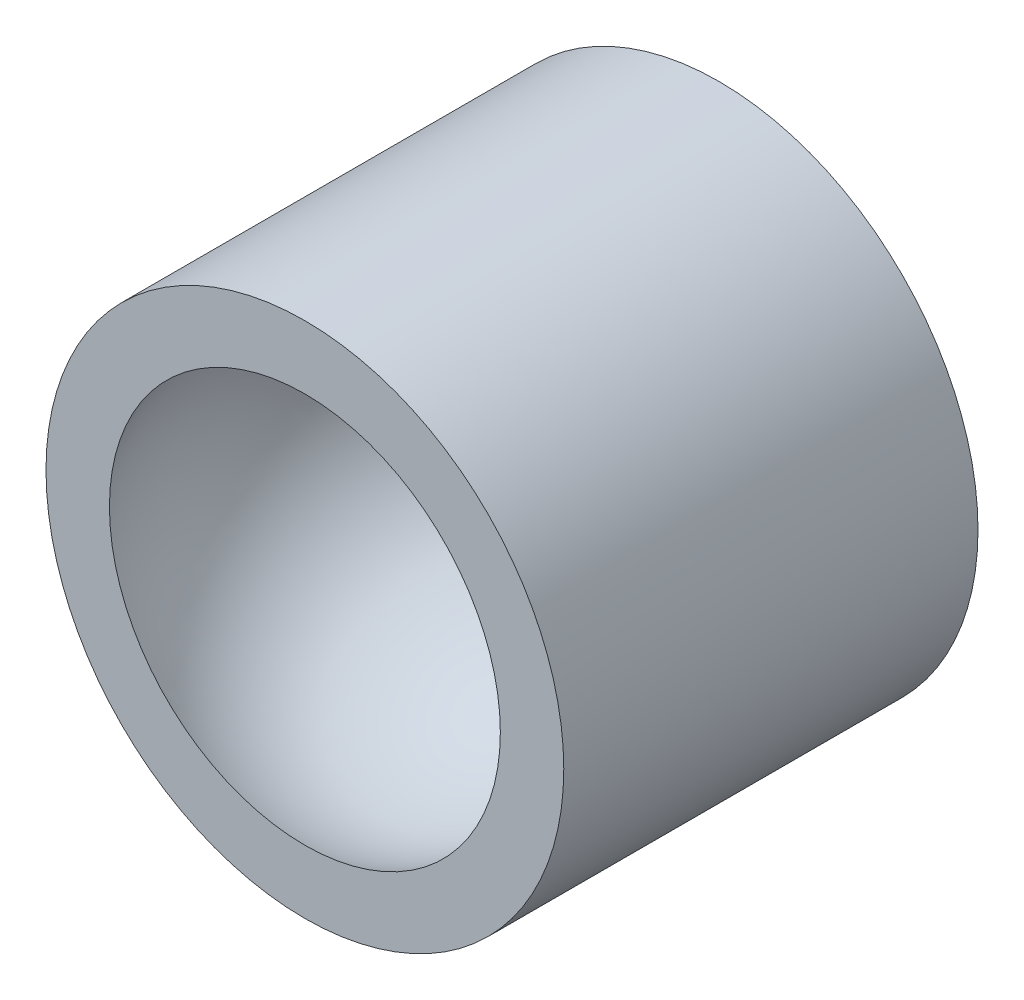
from build123d import *

# Parameters (mm, degrees)
SKETCH_1_R          = 12.5
EXTRUDE_2_DEPTH     = 35
SKETCH_4_R          = 14.624451674
CUT_EXTRUDE_1_DEPTH = 15


with BuildPart() as part:
    # 스케치1 → 보스-돌출2 (new body)
    with BuildSketch(Plane.XY):
        Circle(SKETCH_1_R)
    extrude(amount=EXTRUDE_2_DEPTH)

    # 스케치3 → 컷-회전1 (revolve, cut)
    with BuildSketch(Plane(origin=(0, 0, 0), x_dir=(1, 0, 0), z_dir=(0, 1, 0))):
        with BuildLine():
            Line((0, -21), (0, -41))
            ThreePointArc((0, -41), (-10, -31), (0, -21))
        make_face()
    revolve(axis=Axis((0, 0, 35), (0, 0, -1)), mode=Mode.SUBTRACT)

    # 스케치4 → 컷-돌출1 (cut)
    with BuildSketch(Plane(origin=(0, 0, 0), x_dir=(-1, 0, 0), z_dir=(0, 0, -1))):
        Circle(SKETCH_4_R)
    extrude(amount=-CUT_EXTRUDE_1_DEPTH, mode=Mode.SUBTRACT)

    # 스케치5 → 컷-회전2 (revolve, cut)
    with BuildSketch(Plane(origin=(0, 0, 0), x_dir=(1, 0, 0), z_dir=(0, 1, 0))):
        with BuildLine():
            Line((0, -20.75), (0, -41.25))
            ThreePointArc((0, -41.25), (-10.25, -31), (0, -20.75))
        make_face()
    revolve(axis=Axis((0, 0, 35), (0, 0, -1)), mode=Mode.SUBTRACT)


solid = part.part
